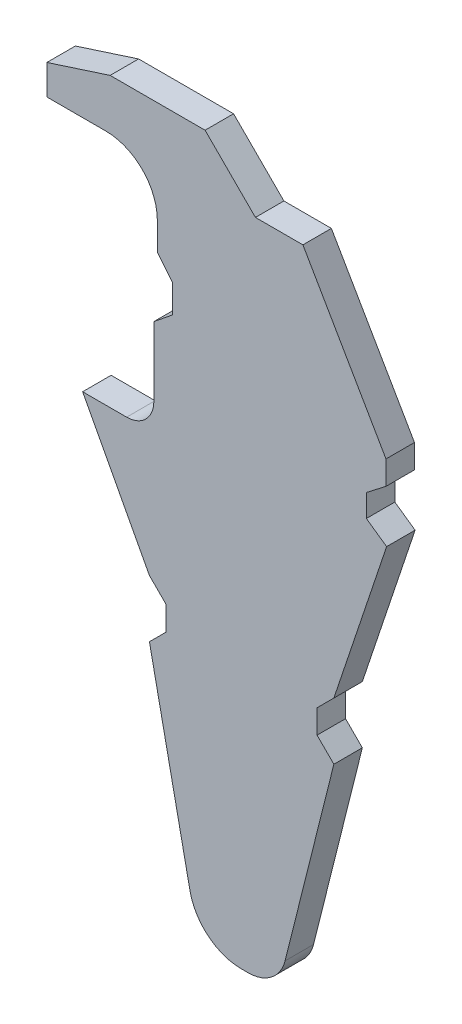
from build123d import *

# Parameters (mm, degrees)
BOSS_EXTRUDE1_DEPTH = 6


with BuildPart() as part:
    # Sketch1 → Boss-Extrude1 (new body)
    with BuildSketch(Plane.XY):
        with BuildLine():
            Line((-53.972535853, 62.272181808), (-33.972535853, 62.272181808))
            Line((-33.972535853, 62.272181808), (-23.365934135, 51.66558009))
            Line((-23.365934135, 51.66558009), (-13.365934135, 51.66558009))
            Line((-13.365934135, 51.66558009), (4.134065865, 21.354690958))
            Line((4.134065865, 21.354690958), (4.134065865, 16.354690958))
            Line((4.134065865, 16.354690958), (0, 13.164382856))
            Line((0, 13.164382856), (0, 8.42299495))
            Line((0, 8.42299495), (4.271457393, 5.432088284))
            Line((4.271457393, 5.432088284), (-6.845344252, -27.755510623))
            Line((-6.845344252, -27.755510623), (-10.380878157, -31.291044529))
            Line((-10.380878157, -31.291044529), (-10.380878157, -36.291044529))
            Line((-10.380878157, -36.291044529), (-6.845344252, -39.826578434))
            Line((-6.845344252, -39.826578434), (-17.123685718, -80.844353089))
            ThreePointArc((-17.123685718, -80.844353089), (-19.962191865, -85.206806077), (-24.883760746, -86.899813152))
            Line((-24.883760746, -86.899813152), (-26.310778978, -86.899813152))
            ThreePointArc((-26.310778978, -86.899813152), (-33.291799073, -84.418493944), (-37.140699325, -78.087810456))
            Line((-37.140699325, -78.087810456), (-45.693891705, -36.899813152))
            Line((-45.693891705, -36.899813152), (-42.158357799, -33.364279246))
            Line((-42.158357799, -33.364279246), (-42.158357799, -28.364279246))
            Line((-42.158357799, -28.364279246), (-45.693891705, -24.828745341))
            Line((-45.693891705, -24.828745341), (-59.766941125, 1.66558009))
            Line((-59.766941125, 1.66558009), (-50.494368268, 1.66558009))
            ThreePointArc((-50.494368268, 1.66558009), (-46.444465696, 3.343104662), (-44.766941125, 7.393007234))
            Line((-44.766941125, 7.393007234), (-44.766941125, 21.96147854))
            Line((-44.766941125, 21.96147854), (-40.881118733, 25.10796616))
            Line((-40.881118733, 25.10796616), (-40.881118733, 31.10796616))
            Line((-40.881118733, 31.10796616), (-44.027606353, 34.993788551))
            Line((-44.027606353, 34.993788551), (-44.027606353, 40.822331304))
            ThreePointArc((-44.027606353, 40.822331304), (-47.203520392, 48.489666051), (-54.870855139, 51.66558009))
            Line((-54.870855139, 51.66558009), (-67.295502145, 51.66558009))
            Line((-67.295502145, 51.66558009), (-67.295502145, 57.971185507))
            Line((-67.295502145, 57.971185507), (-53.972535853, 62.272181808))
        make_face()
    extrude(amount=BOSS_EXTRUDE1_DEPTH)


solid = part.part
